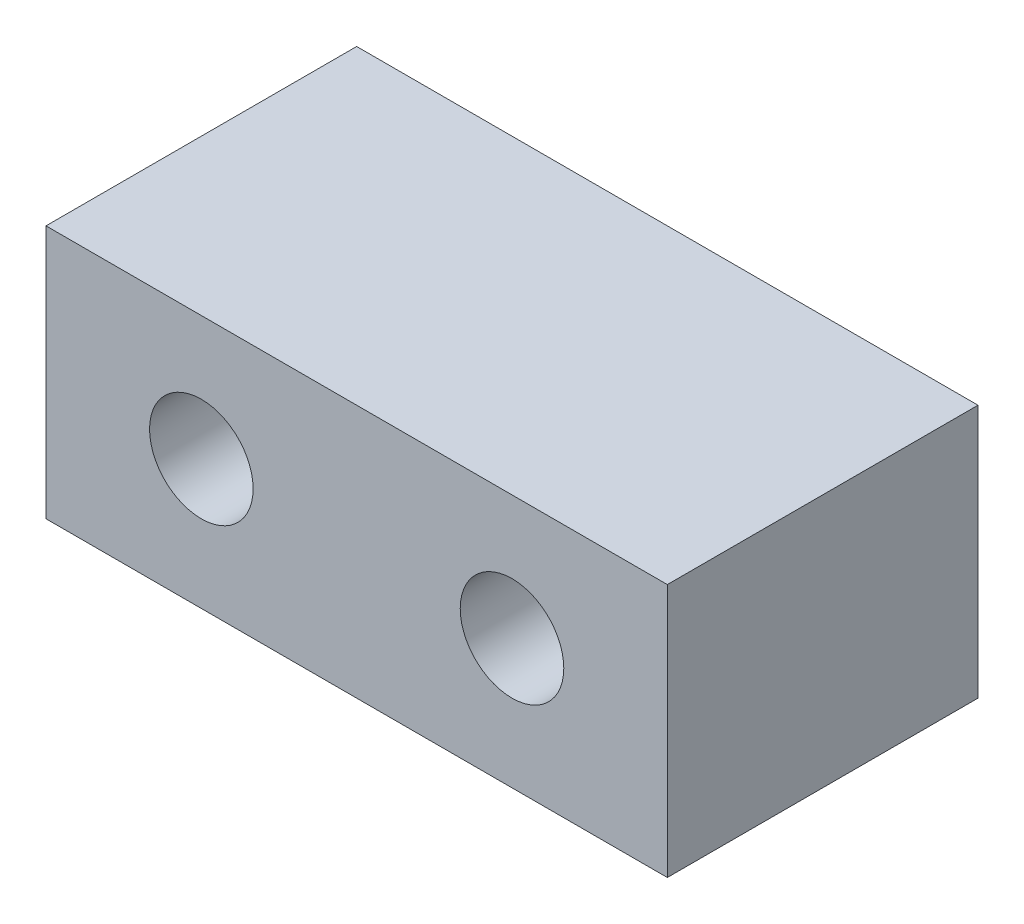
from build123d import *

# Parameters (mm, degrees)
SKETCH1_W           = 30
SKETCH1_H           = 14.7
SKETCH1_R           = 2.5
BOSS_EXTRUDE1_DEPTH = 15
SKETCH4_R           = 4.5
CUT_EXTRUDE1_DEPTH  = 6
SKETCH6_W           = 43.790019277
SKETCH6_H           = 8.282134106
CUT_EXTRUDE2_DEPTH  = 23.45044543


with BuildPart() as part:
    # Sketch1 → Boss-Extrude1 (new body)
    with BuildSketch(Plane.XY):
        Rectangle(SKETCH1_W, SKETCH1_H)
        with Locations((7.5, 1.35)):
            Circle(SKETCH1_R, mode=Mode.SUBTRACT)
        with Locations((-7.5, 1.35)):
            Circle(SKETCH1_R, mode=Mode.SUBTRACT)
    extrude(amount=BOSS_EXTRUDE1_DEPTH)

    # Sketch4 → Cut-Extrude1 (cut)
    with BuildSketch(Plane(origin=(0, 0, 0), x_dir=(-1, 0, 0), z_dir=(0, 0, -1))):
        with Locations((-7.5, 1.35)):
            Circle(SKETCH4_R)
        with Locations((7.5, 1.35)):
            Circle(SKETCH4_R)
    extrude(amount=-CUT_EXTRUDE1_DEPTH, mode=Mode.SUBTRACT)

    # Sketch6 → Cut-Extrude2 (cut, through all)
    with BuildSketch(Plane(origin=(0, 0, 0), x_dir=(-1, 0, 0), z_dir=(0, 0, -1))):
        with Locations((2.714530428, -9.041067053)):
            Rectangle(SKETCH6_W, SKETCH6_H)
    extrude(amount=-CUT_EXTRUDE2_DEPTH, mode=Mode.SUBTRACT)


solid = part.part
